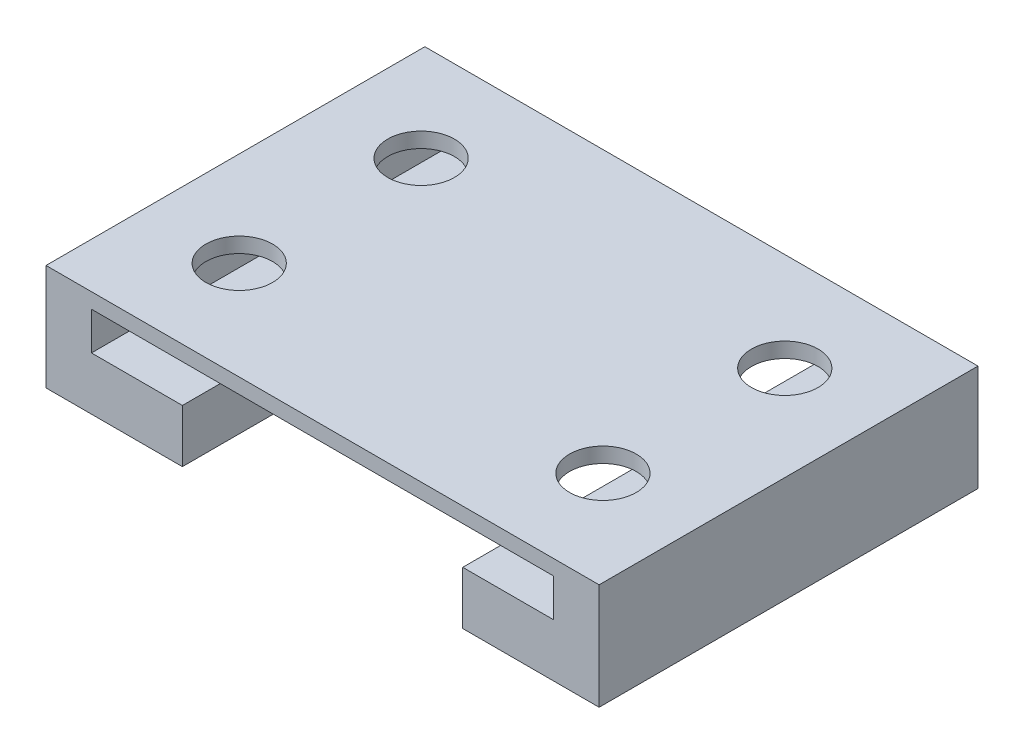
from build123d import *

# Parameters (mm, degrees)
EXTRUDE_3_DEPTH             = 12.5
HOLE_WIZARD_M21_D           = 2.4
HOLE_WIZARD_M21_CSINK_D     = 4.4
HOLE_WIZARD_M21_CSINK_ANGLE = 90
CUT_EXTRUDE_1_REACH         = 25.202
SKETCH_6_R                  = 2.2


with BuildPart() as part:
    # Эскиз3 → Бобышка-Вытянуть3 (new, symmetric)
    with BuildSketch(Plane.XY):
        Polygon((-9.25, 0), (-18.25, 0), (-18.25, 7), (18.25, 7), (18.25, 0), (9.25, 0), (9.25, 3.5), (15.25, 3.5), (15.25, 6), (-15.25, 6), (-15.25, 3.5), (-9.25, 3.5), align=None)
    extrude(amount=EXTRUDE_3_DEPTH, both=True)

    # Зенковка для винта с потайной головкой M21 (through all)
    with Locations(Plane(origin=(0, 7, 0), x_dir=(1, 0, 0), z_dir=(0, 1, 0))):
        with Locations((-12, 6), (-12, -6), (12, -6), (12, 6)):
            CounterSinkHole(HOLE_WIZARD_M21_D / 2, HOLE_WIZARD_M21_CSINK_D / 2, counter_sink_angle=HOLE_WIZARD_M21_CSINK_ANGLE)

    # Эскиз6 → Вырез-Вытянуть1 (cut, up to next)
    with BuildSketch(Plane(origin=(0, 7, 0), x_dir=(1, 0, 0), z_dir=(0, 1, 0)), mode=Mode.PRIVATE) as cut_extrude_1_sk1:
        with Locations(Location((-12, -6, 0), (0, 0, 180))):
            Circle(SKETCH_6_R)
    cut_extrude_1_tool1 = extrude(cut_extrude_1_sk1.sketch, amount=-CUT_EXTRUDE_1_REACH, mode=Mode.PRIVATE) & part.part
    # Эскиз6 → Вырез-Вытянуть1 (cut, up to next)
    with BuildSketch(Plane(origin=(0, 7, 0), x_dir=(1, 0, 0), z_dir=(0, 1, 0)), mode=Mode.PRIVATE) as cut_extrude_1_sk2:
        with Locations(Location((12, -6, 0), (0, 0, 180))):
            Circle(SKETCH_6_R)
    cut_extrude_1_tool2 = extrude(cut_extrude_1_sk2.sketch, amount=-CUT_EXTRUDE_1_REACH, mode=Mode.PRIVATE) & part.part
    # Эскиз6 → Вырез-Вытянуть1 (cut, up to next)
    with BuildSketch(Plane(origin=(0, 7, 0), x_dir=(1, 0, 0), z_dir=(0, 1, 0)), mode=Mode.PRIVATE) as cut_extrude_1_sk3:
        with Locations(Location((12, 6, 0), (0, 0, 180))):
            Circle(SKETCH_6_R)
    cut_extrude_1_tool3 = extrude(cut_extrude_1_sk3.sketch, amount=-CUT_EXTRUDE_1_REACH, mode=Mode.PRIVATE) & part.part
    # Эскиз6 → Вырез-Вытянуть1 (cut, up to next)
    with BuildSketch(Plane(origin=(0, 7, 0), x_dir=(1, 0, 0), z_dir=(0, 1, 0)), mode=Mode.PRIVATE) as cut_extrude_1_sk4:
        with Locations(Location((-12, 6, 0), (0, 0, 180))):
            Circle(SKETCH_6_R)
    cut_extrude_1_tool4 = extrude(cut_extrude_1_sk4.sketch, amount=-CUT_EXTRUDE_1_REACH, mode=Mode.PRIVATE) & part.part
    add(cut_extrude_1_tool1.solids().sort_by_distance((-12, 7, 6))[0], mode=Mode.SUBTRACT)
    add(cut_extrude_1_tool2.solids().sort_by_distance((12, 7, 6))[0], mode=Mode.SUBTRACT)
    add(cut_extrude_1_tool3.solids().sort_by_distance((12, 7, -6))[0], mode=Mode.SUBTRACT)
    add(cut_extrude_1_tool4.solids().sort_by_distance((-12, 7, -6))[0], mode=Mode.SUBTRACT)


solid = part.part
